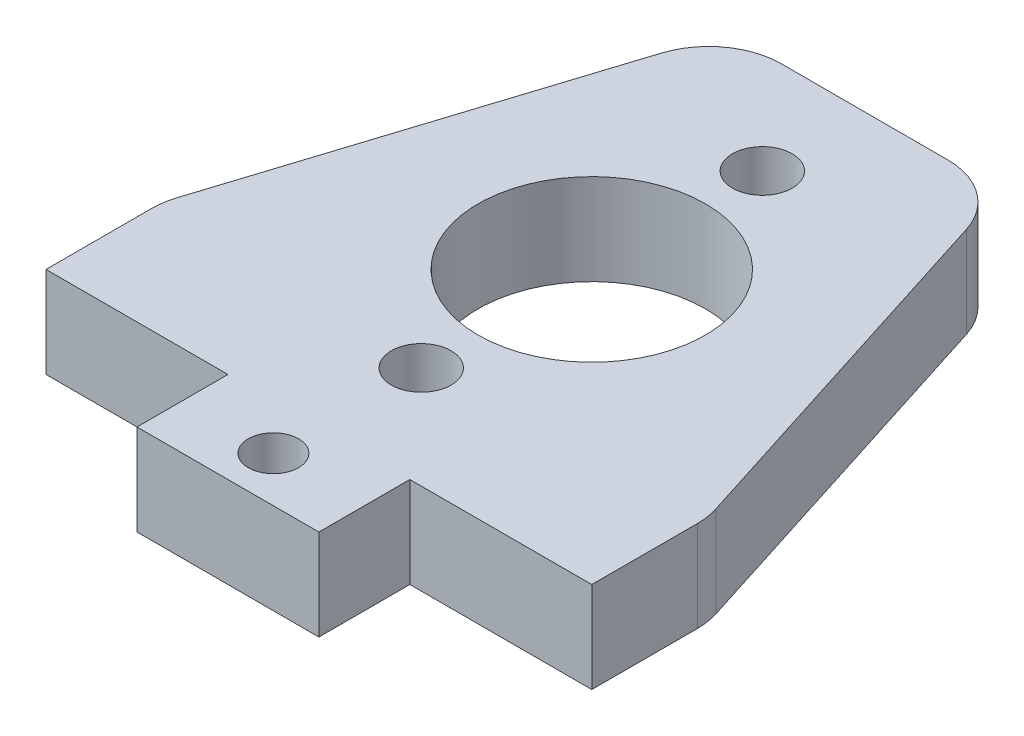
from build123d import *

# Parameters (mm, degrees)
SKETCH1_R           = 1.7526
BOSS_EXTRUDE1_DEPTH = 3.175
FILLET1_R           = 5.08
FILLET2_R           = 5.08
SKETCH2_R           = 2.0828
SKETCH2_R_2         = 7.9375
CUT_EXTRUDE1_DEPTH  = 49.775275499


with BuildPart() as part:
    # Sketch1 → Boss-Extrude1 (new, symmetric)
    with BuildSketch(Plane(origin=(0, 0, 0), x_dir=(1, 0, 0), z_dir=(0, 1, 0))):
        Polygon((-19.05, -38.1), (-6.35, -38.1), (-6.35, -44.45), (6.35, -44.45), (6.35, -38.1), (19.05, -38.1), (19.05, -29.9466), (9.525, 0), (-9.525, 0), (-19.05, -29.9466), align=None)
        with Locations(Location((0, -41.275, 0), (0, 0, 270))):
            Circle(SKETCH1_R, mode=Mode.SUBTRACT)
    extrude(amount=BOSS_EXTRUDE1_DEPTH, both=True)

    # Fillet1
    fillet1_edges = [part.edges().sort_by_distance(p)[0] for p in [
        (-9.525, 0, 0),
        (9.525, 0, 0),
    ]]
    fillet(fillet1_edges, radius=FILLET1_R)

    # Fillet2
    fillet2_edges = [part.edges().sort_by_distance(p)[0] for p in [
        (-19.05, 0, 29.9466),
        (19.05, 0, 29.9466),
    ]]
    fillet(fillet2_edges, radius=FILLET2_R)

    # Sketch2 → Cut-Extrude1 (cut, through all)
    with BuildSketch(Plane(origin=(0, 3.175, 0), x_dir=(1, 0, 0), z_dir=(0, 1, 0))):
        with Locations(Location((0, -7.14375, 0), (0, 0, 270))):
            Circle(SKETCH2_R)
        with Locations(Location((0, -19.05, 0), (0, 0, 270))):
            Circle(SKETCH2_R_2)
        with Locations(Location((0, -30.95625, 0), (0, 0, 90))):
            Circle(SKETCH2_R)
    extrude(amount=-CUT_EXTRUDE1_DEPTH, mode=Mode.SUBTRACT)


solid = part.part
